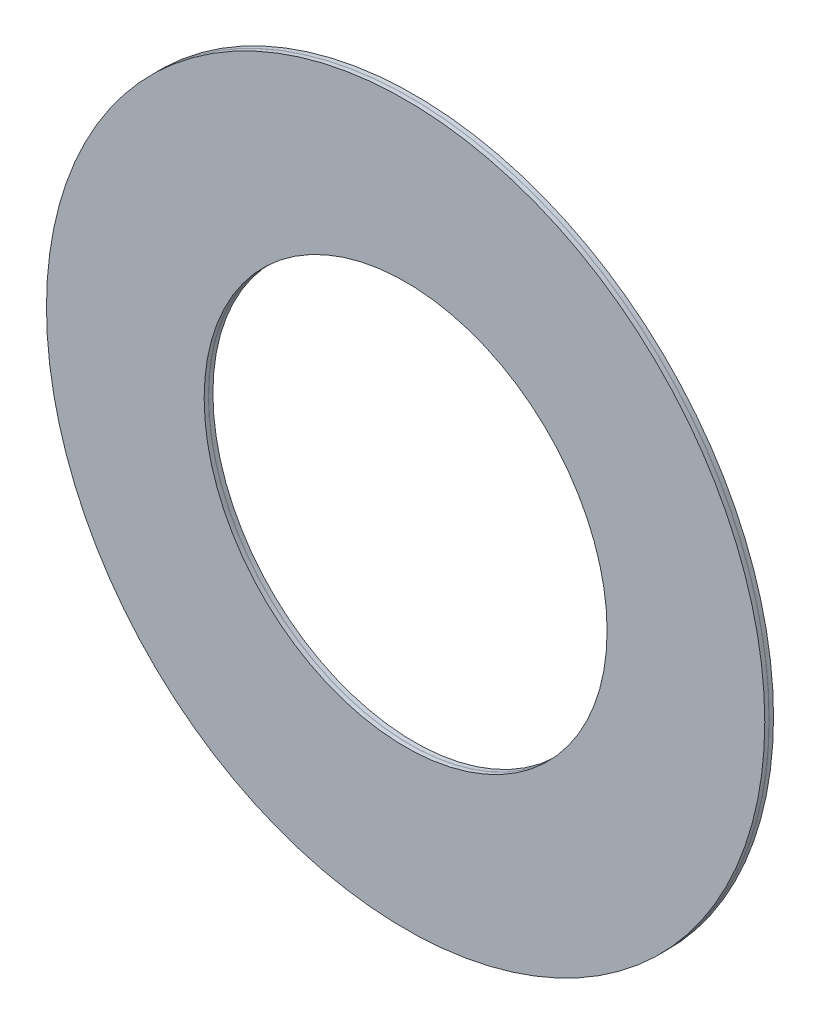
from build123d import *

# Parameters (mm, degrees)
SKETCH3_W = 0.0508
SKETCH3_H = 28.575
SKETCH4_W = 0.76835
SKETCH4_H = 28.575


with BuildPart() as part:
    # Sketch3 → Revolve1 (revolve)
    with BuildSketch(Plane(origin=(0, 0, 0), x_dir=(0, 0, -1), z_dir=(1, 0, 0)), mode=Mode.PRIVATE) as revolve1_sk:
        with Locations((0, 50.8)):
            Rectangle(SKETCH3_W, SKETCH3_H)
    revolve(revolve1_sk.sketch.rotate(Axis((0, 0, -0.79375), (0, 0, 1)), 90), axis=Axis((0, 0, -0.79375), (0, 0, 1)))


with BuildPart() as body_2:
    # Sketch4 → Revolve2 (revolve)
    with BuildSketch(Plane(origin=(0, 0, 0), x_dir=(0, 0, -1), z_dir=(1, 0, 0)), mode=Mode.PRIVATE) as revolve2_sk:
        with Locations((-0.409575, 50.8)):
            Rectangle(SKETCH4_W, SKETCH4_H)
        with Locations((0.409575, 50.8)):
            Rectangle(SKETCH4_W, SKETCH4_H)
    revolve(revolve2_sk.sketch.rotate(Axis((0, 0, -0.79375), (0, 0, 1)), 90), axis=Axis((0, 0, -0.79375), (0, 0, 1)))


solid = Compound([part.part, body_2.part])
